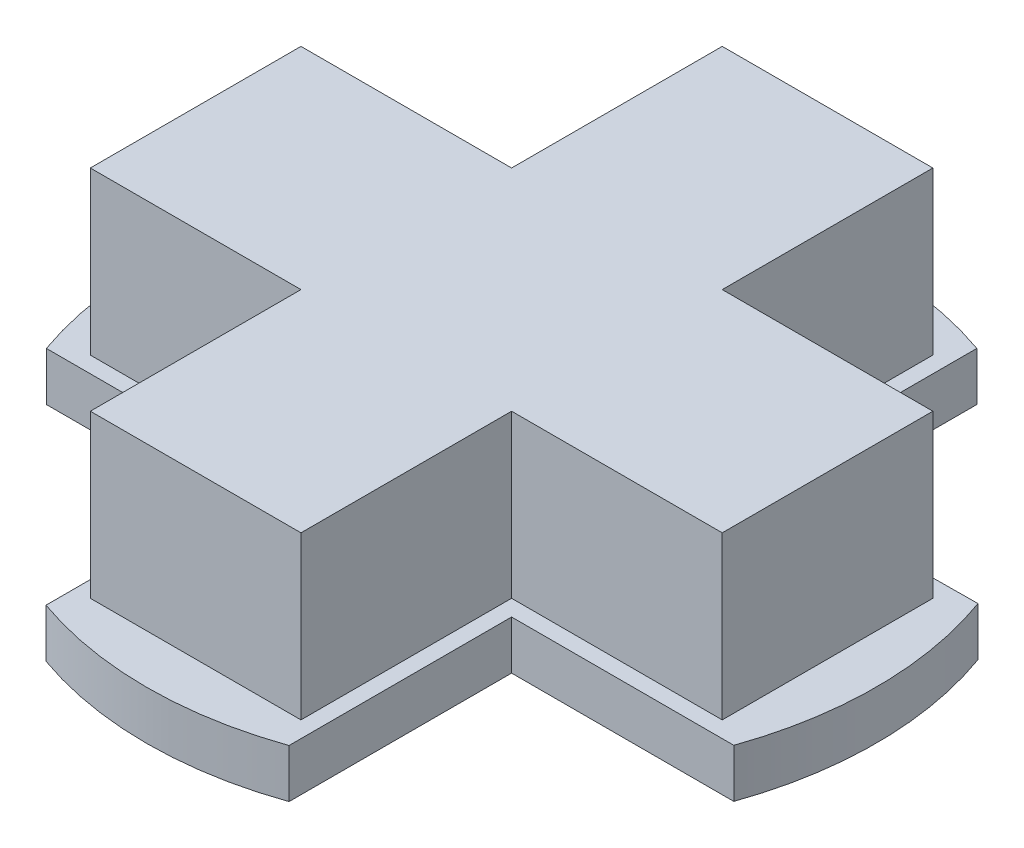
from build123d import *

# Parameters (mm, degrees)
EXTRUDE_2_DEPTH = 1.8
EXTRUDE_3_DEPTH = 6


with BuildPart() as part:
    # 草图3 → 凸台-拉伸2 (new body)
    with BuildSketch(Plane(origin=(0, 0, 0), x_dir=(1, 0, 0), z_dir=(0, 1, 0))):
        with BuildLine():
            Line((-12.727922061, 4.5), (-4.5, 4.5))
            Line((-4.5, 4.5), (-4.5, 12.727922061))
            ThreePointArc((-4.5, 12.727922061), (0, 13.5), (4.5, 12.727922061))
            Line((4.5, 12.727922061), (4.5, 4.5))
            Line((4.5, 4.5), (12.703836594, 4.567552496))
            ThreePointArc((12.703836594, 4.567552496), (13.499952375, 0.035858923), (12.727922061, -4.5))
            Line((12.727922061, -4.5), (4.5, -4.5))
            Line((4.5, -4.5), (4.5, -12.741400862))
            ThreePointArc((4.5, -12.741400862), (0, -13.512708682), (-4.5, -12.741400862))
            Line((-4.5, -12.741400862), (-4.5, -4.5))
            Line((-4.5, -4.5), (-12.727922061, -4.5))
            ThreePointArc((-12.727922061, -4.5), (-13.5, 0), (-12.727922061, 4.5))
        make_face()
    extrude(amount=EXTRUDE_2_DEPTH)

    # 草图4 → 凸台-拉伸3 (add)
    with BuildSketch(Plane(origin=(0, 1.8, 0), x_dir=(1, 0, 0), z_dir=(0, 1, 0))):
        Polygon((3.9, -11.7), (-3.9, -11.7), (-3.9, -3.9), (-11.7, -3.9), (-11.7, 3.9), (-3.9, 3.9), (-3.9, 11.7), (3.9, 11.7), (3.9, 3.9), (11.7, 3.9), (11.7, -3.9), (3.9, -3.9), align=None)
    extrude(amount=EXTRUDE_3_DEPTH)


solid = part.part
